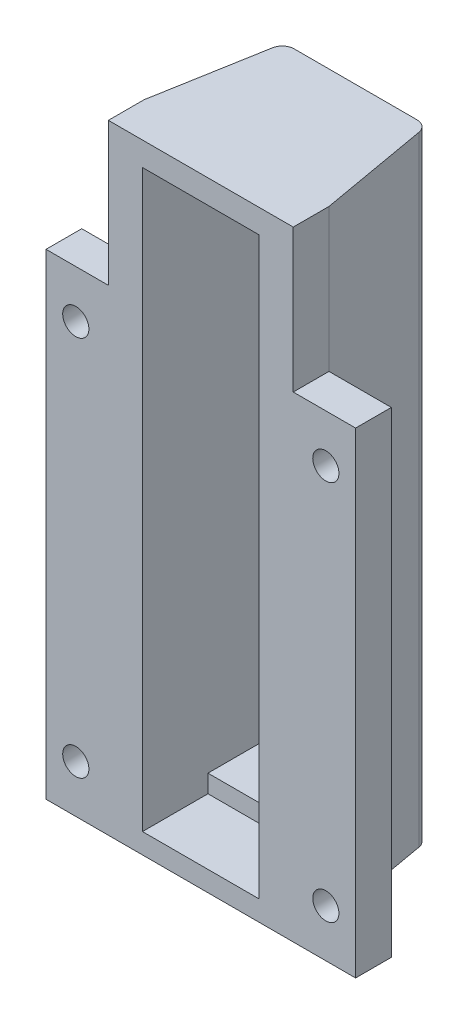
from build123d import *

# Parameters (mm, degrees)
EXTRUDE_1_DEPTH     = 40
EXTRUDE_2_DEPTH     = 12
SKETCH_3_W          = 9.8
SKETCH_3_H          = 45.3
CUT_EXTRUDE_1_DEPTH = 10
SKETCH_4_W          = 9.8
SKETCH_4_H          = 48.3
CUT_EXTRUDE_2_DEPTH = 5.5
SKETCH_5_R          = 1.1
CUT_EXTRUDE_3_DEPTH = 56.154328933
SKETCH_6_W          = 3.5
SKETCH_6_H          = 35
CUT_EXTRUDE_4_DEPTH = 55.525223521
SKETCH_7_R          = 1.1
CUT_EXTRUDE_5_DEPTH = 55.525223521
SKETCH_8_R          = 1.95
CUT_EXTRUDE_6_DEPTH = 1.2
FILLET_2_R          = 1


with BuildPart() as part:
    # 草图1 → 凸台-拉伸1 (new body)
    with BuildSketch(Plane(origin=(0, 0, 0), x_dir=(1, 0, 0), z_dir=(0, 1, 0))):
        Polygon((-6, 11.5), (-7.763269807, 1.5), (7.763269807, 1.5), (6, 11.5), align=None)
        Polygon((-7.763269807, 1.5), (-8.292250749, -1.5), (8.292250749, -1.5), (7.763269807, 1.5), align=None)
        Polygon((-13, 1.5), (-13, -1.5), (-8.292250749, -1.5), (-7.763269807, 1.5), align=None)
        Polygon((7.763269807, 1.5), (8.292250749, -1.5), (13, -1.5), (13, 1.5), align=None)
    extrude(amount=EXTRUDE_1_DEPTH)

    # 草图2 → 凸台-拉伸2 (add)
    with BuildSketch(Plane(origin=(0, 40, 0), x_dir=(1, 0, 0), z_dir=(0, 1, 0))):
        Polygon((6, 11.5), (7.763269807, 1.5), (7.763269807, -1.5), (-7.763269807, -1.5), (-7.763269807, 1.5), (-6, 11.5), align=None)
    extrude(amount=EXTRUDE_2_DEPTH)

    # 草图3 → 切除-拉伸1 (cut)
    with BuildSketch(Plane.XY.offset(1.5)):
        with Locations((0, 25.85)):
            Rectangle(SKETCH_3_W, SKETCH_3_H)
    extrude(amount=-CUT_EXTRUDE_1_DEPTH, mode=Mode.SUBTRACT)

    # 草图4 → 切除-拉伸2 (cut)
    with BuildSketch(Plane.XY.offset(1.5)):
        with Locations((0, 25.85)):
            Rectangle(SKETCH_4_W, SKETCH_4_H)
    extrude(amount=-CUT_EXTRUDE_2_DEPTH, mode=Mode.SUBTRACT)

    # 草图5 → 切除-拉伸3 (cut, through all)
    with BuildSketch(Plane.XY.offset(1.5)):
        with Locations((-10.5, 36)):
            Circle(SKETCH_5_R)
        with Locations(Location((-10.5, 4, 0), (0, 0, 180))):
            Circle(SKETCH_5_R)
        with Locations((10.5, 4)):
            Circle(SKETCH_5_R)
        with Locations(Location((10.5, 36, 0), (0, 0, 180))):
            Circle(SKETCH_5_R)
    extrude(amount=-CUT_EXTRUDE_3_DEPTH, mode=Mode.SUBTRACT)

    # 草图6 → 切除-拉伸4 (cut, through all)
    with BuildSketch(Plane.XY.offset(-8.5)):
        with Locations((0, 25.85)):
            Rectangle(SKETCH_6_W, SKETCH_6_H)
    extrude(amount=-CUT_EXTRUDE_4_DEPTH, mode=Mode.SUBTRACT)

    # 草图7 → 切除-拉伸5 (cut, through all)
    with BuildSketch(Plane.XY.offset(-8.5)):
        with Locations((0, 46.35)):
            Circle(SKETCH_7_R)
        with Locations(Location((0, 5.35, 0), (0, 0, 180))):
            Circle(SKETCH_7_R)
    extrude(amount=-CUT_EXTRUDE_5_DEPTH, mode=Mode.SUBTRACT)

    # 草图8 → 切除-拉伸6 (cut)
    with BuildSketch(Plane(origin=(0, 0, -11.5), x_dir=(-1, 0, 0), z_dir=(0, 0, -1))):
        with Locations((0, 46.35)):
            Circle(SKETCH_8_R)
        with Locations((0, 5.35)):
            Circle(SKETCH_8_R)
    extrude(amount=-CUT_EXTRUDE_6_DEPTH, mode=Mode.SUBTRACT)

    # 圆角2
    fillet_2_edges = [part.edges().sort_by_distance(p)[0] for p in [
        (6, 26, -11.5),
        (-6, 26, -11.5),
    ]]
    fillet(fillet_2_edges, radius=FILLET_2_R)


solid = part.part
